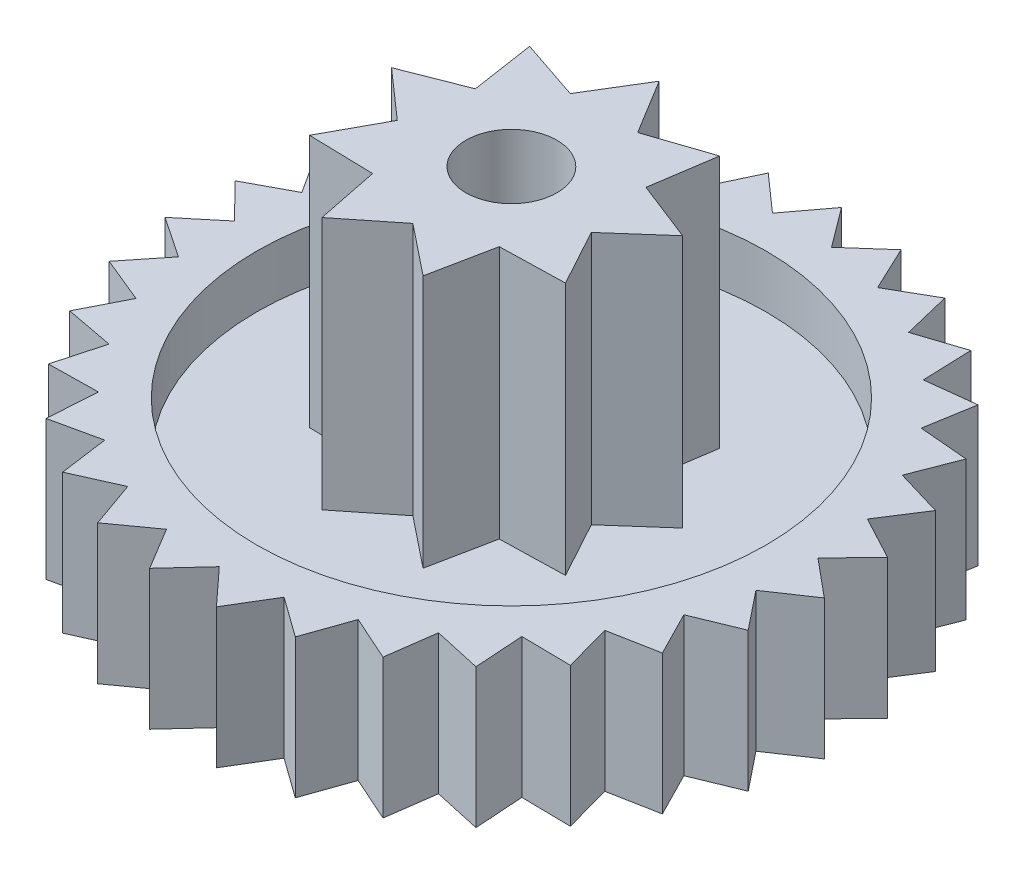
from build123d import *

# Parameters (mm, degrees)
SKETCH3_R          = 7.2
CUT_EXTRUDE1_DEPTH = 11.312366363
SKETCH4_R          = 3.5
CUT_EXTRUDE2_DEPTH = 5.14
SKETCH5_R          = 0.925
CUT_EXTRUDE3_DEPTH = 12.956372442


with BuildPart() as part:
    # Sketch1 → Revolve1 (revolve)
    with BuildSketch(Plane.XY, mode=Mode.PRIVATE) as revolve1_sk:
        Polygon((0, 7.3), (0, 0), (1.97, 0), (1.97, 0.9), (5.17, 0.9), (5.17, 0.4), (6.7, 0.4), (6.7, 3.23), (5.17, 3.23), (5.17, 2.16), (3, 2.16), (3, 7.3), align=None)
    revolve(revolve1_sk.sketch.rotate(Axis((0, 7.3, 0), (0, -1, 0)), 90), axis=Axis((0, 7.3, 0), (0, -1, 0)))

    # Sketch3 → Cut-Extrude1 (cut, through all)
    with BuildSketch(Plane(origin=(0, 3.23, 0), x_dir=(1, 0, 0), z_dir=(0, 1, 0))):
        Circle(SKETCH3_R)
        Polygon((0, 6.7), (-0.599928149, 5.899575088), (-1.348700085, 6.562850606), (-1.775223319, 5.65804579), (-2.642184229, 6.157017338), (-2.877840638, 5.184875434), (-3.827497041, 5.499115056), (-3.862638823, 4.499435668), (-4.856111674, 4.616078358), (-4.68930012, 3.629788477), (-5.685916525, 3.544058869), (-5.32398092, 2.611537319), (-6.282939285, 2.326945194), (-5.740697315, 1.486369516), (-6.622737773, 1.014566109), (-5.922388888, 0.300349571), (-6.691400598, -0.339349431), (-5.861617163, -0.897966721), (-6.486116696, -1.679371966), (-5.560870144, -2.059520149), (-6.015290415, -2.950640815), (-5.032460447, -3.136756581), (-5.298197437, -4.101110083), (-4.298021228, -4.08557383), (-4.364195634, -5.083679422), (-3.387620516, -4.867127206), (-3.251523149, -5.858122328), (-2.338530221, -5.449419823), (-2.005732924, -6.392733018), (-1.193700224, -5.808612552), (-0.677827757, -6.665624467), (0, -5.93), (0.677827757, -6.665624467), (1.193700224, -5.808612552), (2.005732924, -6.392733018), (2.338530221, -5.449419823), (3.251523149, -5.858122328), (3.387620516, -4.867127206), (4.364195634, -5.083679422), (4.298021228, -4.08557383), (5.298197437, -4.101110083), (5.032460447, -3.136756581), (6.015290415, -2.950640815), (5.560870144, -2.059520149), (6.486116696, -1.679371966), (5.861617163, -0.897966721), (6.691400598, -0.339349431), (5.922388888, 0.300349571), (6.622737773, 1.014566109), (5.740697315, 1.486369516), (6.282939285, 2.326945194), (5.32398092, 2.611537319), (5.685916525, 3.544058869), (4.68930012, 3.629788477), (4.856111674, 4.616078358), (3.862638823, 4.499435668), (3.827497041, 5.499115056), (2.877840638, 5.184875434), (2.642184229, 6.157017338), (1.775223319, 5.65804579), (1.348700085, 6.562850606), (0.599928149, 5.899575088), align=None, mode=Mode.SUBTRACT)
    extrude(amount=-CUT_EXTRUDE1_DEPTH, mode=Mode.SUBTRACT)

    # Sketch4 → Cut-Extrude2 (cut)
    with BuildSketch(Plane(origin=(0, 7.3, 0), x_dir=(1, 0, 0), z_dir=(0, 1, 0))):
        Circle(SKETCH4_R)
        Polygon((0, 3), (-0.684040287, 1.879385242), (-1.928362829, 2.298133329), (-1.732050808, 1), (-2.954423259, 0.520944533), (-1.969615506, -0.347296355), (-2.598076211, -1.5), (-1.285575219, -1.532088886), (-1.02606043, -2.819077862), (0, -2), (1.02606043, -2.819077862), (1.285575219, -1.532088886), (2.598076211, -1.5), (1.969615506, -0.347296355), (2.954423259, 0.520944533), (1.732050808, 1), (1.928362829, 2.298133329), (0.684040287, 1.879385242), align=None, mode=Mode.SUBTRACT)
    extrude(amount=-CUT_EXTRUDE2_DEPTH, mode=Mode.SUBTRACT)

    # Sketch5 → Cut-Extrude3 (cut, through all)
    with BuildSketch(Plane(origin=(0, 7.3, 0), x_dir=(1, 0, 0), z_dir=(0, 1, 0))):
        with Locations(Location((0, 0, 0), (0, 0, 270))):
            Circle(SKETCH5_R)
    extrude(amount=-CUT_EXTRUDE3_DEPTH, mode=Mode.SUBTRACT)


solid = part.part
